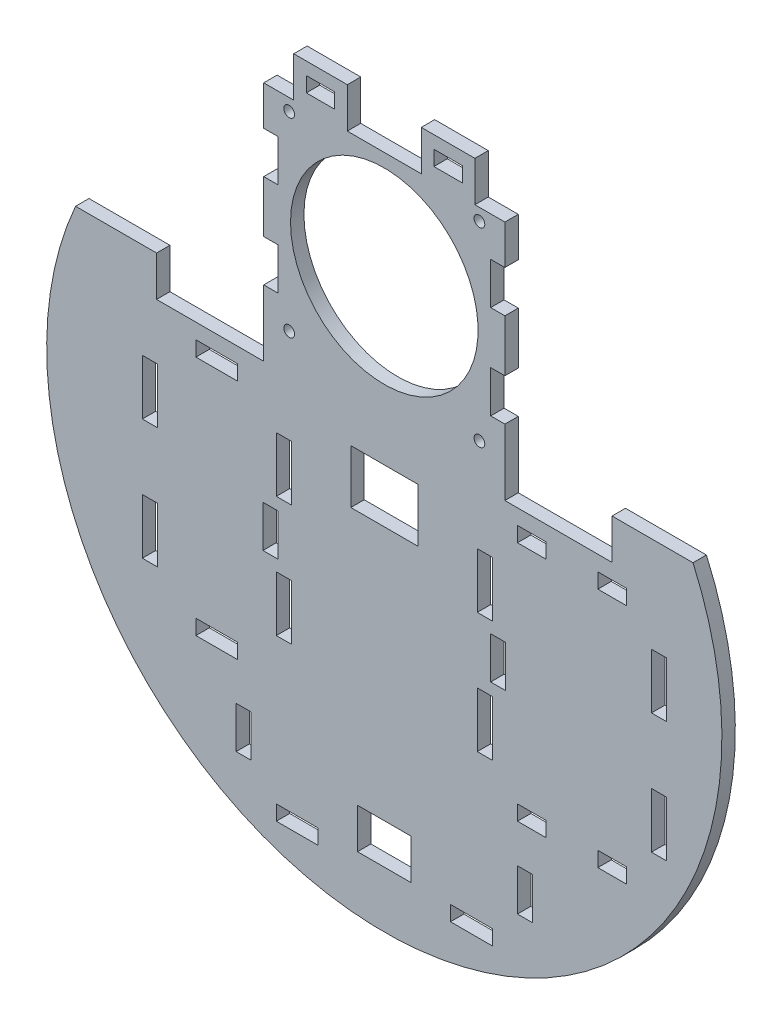
from build123d import *

# Parameters (mm, degrees)
SKETCH1_R           = 35
SKETCH1_R_2         = 2
SKETCH1_W           = 20
SKETCH1_H           = 15
SKETCH1_W_2         = 25
SKETCH1_H_2         = 20
SKETCH1_W_3         = 10.6
SKETCH1_H_3         = 5.6
SKETCH1_W_4         = 15.6
SKETCH1_W_5         = 5.6
SKETCH1_H_4         = 20.6
SKETCH1_H_5         = 15.6
BOSS_EXTRUDE1_DEPTH = 5


with BuildPart() as part:
    # Sketch1 → Boss-Extrude1 (new body)
    with BuildSketch(Plane(origin=(0, 0, 0), x_dir=(-1, 0, 0), z_dir=(0, 0, -1))):
        with BuildLine():
            Line((-25.476672243, 28.966950724), (-36.676672243, 28.966950724))
            Line((-36.676672243, 28.966950724), (-36.676672243, 43.966950724))
            Line((-36.676672243, 43.966950724), (-56.676672243, 43.966950724))
            Line((-56.676672243, 43.966950724), (-56.676672243, 28.966950724))
            Line((-56.676672243, 28.966950724), (-84.276672243, 28.966950724))
            Line((-84.276672243, 28.966950724), (-84.276672243, 43.966950724))
            Line((-84.276672243, 43.966950724), (-104.276672243, 43.966950724))
            Line((-104.276672243, 43.966950724), (-104.276672243, 28.966950724))
            Line((-104.276672243, 28.966950724), (-115.476672243, 28.966950724))
            Line((-115.476672243, 28.966950724), (-115.476672243, 14.266950724))
            Line((-115.476672243, 14.266950724), (-110.176672243, 14.266950724))
            Line((-110.176672243, 14.266950724), (-110.176672243, -1.333049276))
            Line((-110.176672243, -1.333049276), (-115.476672243, -1.333049276))
            Line((-115.476672243, -1.333049276), (-115.476672243, -20.733049276))
            Line((-115.476672243, -20.733049276), (-110.176672243, -20.733049276))
            Line((-110.176672243, -20.733049276), (-110.176672243, -36.333049276))
            Line((-110.176672243, -36.333049276), (-115.476672243, -36.333049276))
            Line((-115.476672243, -36.333049276), (-115.476672243, -61.033049276))
            Line((-115.476672243, -61.033049276), (-155.476672243, -61.033049276))
            Line((-155.476672243, -61.033049276), (-155.476672243, -46.033049276))
            Line((-155.476672243, -46.033049276), (-185.693858461, -46.033049276))
            ThreePointArc((-185.693858461, -46.033049276), (-70.476672243, -223.033049276), (44.740513975, -46.033049276))
            Line((44.740513975, -46.033049276), (14.523327757, -46.033049276))
            Line((14.523327757, -46.033049276), (14.523327757, -61.033049276))
            Line((14.523327757, -61.033049276), (-25.476672243, -61.033049276))
            Line((-25.476672243, -61.033049276), (-25.476672243, -36.333049276))
            Line((-25.476672243, -36.333049276), (-30.776672243, -36.333049276))
            Line((-30.776672243, -36.333049276), (-30.776672243, -20.733049276))
            Line((-30.776672243, -20.733049276), (-25.476672243, -20.733049276))
            Line((-25.476672243, -20.733049276), (-25.476672243, -1.333049276))
            Line((-25.476672243, -1.333049276), (-30.776672243, -1.333049276))
            Line((-30.776672243, -1.333049276), (-30.776672243, 14.266950724))
            Line((-30.776672243, 14.266950724), (-25.476672243, 14.266950724))
            Line((-25.476672243, 14.266950724), (-25.476672243, 28.966950724))
        make_face()
        with Locations((-70.476672243, -11.033049276)):
            Circle(SKETCH1_R, mode=Mode.SUBTRACT)
        with Locations((-34.976672243, 24.466950724)):
            Circle(SKETCH1_R_2, mode=Mode.SUBTRACT)
        with Locations((-105.976672243, 24.466950724)):
            Circle(SKETCH1_R_2, mode=Mode.SUBTRACT)
        with Locations((-105.976672243, -46.533049276)):
            Circle(SKETCH1_R_2, mode=Mode.SUBTRACT)
        with Locations((-34.976672243, -46.533049276)):
            Circle(SKETCH1_R_2, mode=Mode.SUBTRACT)
        with Locations((-70.476672243, -194.533049276)):
            Rectangle(SKETCH1_W, SKETCH1_H, mode=Mode.SUBTRACT)
        with Locations((-70.476672243, -82.033049276)):
            Rectangle(SKETCH1_W_2, SKETCH1_H_2, mode=Mode.SUBTRACT)
        with Locations((-46.676672243, 36.466950724)):
            Rectangle(SKETCH1_W_3, SKETCH1_H_3, mode=Mode.SUBTRACT)
        with Locations((-94.276672243, 36.466950724)):
            Rectangle(SKETCH1_W_3, SKETCH1_H_3, mode=Mode.SUBTRACT)
        with Locations((-7.976672243, -69.533049276)):
            Rectangle(SKETCH1_W_4, SKETCH1_H_3, mode=Mode.SUBTRACT)
        with Locations((17.023327757, -92.033049276)):
            Rectangle(SKETCH1_W_5, SKETCH1_H_4, mode=Mode.SUBTRACT)
        with Locations((-32.976672243, -92.033049276)):
            Rectangle(SKETCH1_W_5, SKETCH1_H_4, mode=Mode.SUBTRACT)
        with Locations((-27.976672243, -114.533049276)):
            Rectangle(SKETCH1_W_5, SKETCH1_H_5, mode=Mode.SUBTRACT)
        with Locations((17.023327757, -137.033049276)):
            Rectangle(SKETCH1_W_5, SKETCH1_H_4, mode=Mode.SUBTRACT)
        with Locations((-7.976672243, -159.533049276)):
            Rectangle(SKETCH1_W_4, SKETCH1_H_3, mode=Mode.SUBTRACT)
        with Locations((-32.976672243, -137.033049276)):
            Rectangle(SKETCH1_W_5, SKETCH1_H_4, mode=Mode.SUBTRACT)
        with Locations((-17.976672243, -184.533049276)):
            Rectangle(SKETCH1_W_5, SKETCH1_H_5, mode=Mode.SUBTRACT)
        with Locations((-37.976672243, -204.533049276)):
            Rectangle(SKETCH1_W_4, SKETCH1_H_3, mode=Mode.SUBTRACT)
        with Locations((-102.976672243, -204.533049276)):
            Rectangle(SKETCH1_W_4, SKETCH1_H_3, mode=Mode.SUBTRACT)
        with Locations((-122.976672243, -184.533049276)):
            Rectangle(SKETCH1_W_5, SKETCH1_H_5, mode=Mode.SUBTRACT)
        with Locations((-125.476672243, -159.533049276)):
            Rectangle(SKETCH1_W_3, SKETCH1_H_3, mode=Mode.SUBTRACT)
        with Locations((-155.476672243, -159.533049276)):
            Rectangle(SKETCH1_W_3, SKETCH1_H_3, mode=Mode.SUBTRACT)
        with Locations((-107.976672243, -137.033049276)):
            Rectangle(SKETCH1_W_5, SKETCH1_H_4, mode=Mode.SUBTRACT)
        with Locations((-172.976672243, -137.033049276)):
            Rectangle(SKETCH1_W_5, SKETCH1_H_4, mode=Mode.SUBTRACT)
        with Locations((-112.976672243, -114.533049276)):
            Rectangle(SKETCH1_W_5, SKETCH1_H_5, mode=Mode.SUBTRACT)
        with Locations((-107.976672243, -92.033049276)):
            Rectangle(SKETCH1_W_5, SKETCH1_H_4, mode=Mode.SUBTRACT)
        with Locations((-172.976672243, -92.033049276)):
            Rectangle(SKETCH1_W_5, SKETCH1_H_4, mode=Mode.SUBTRACT)
        with Locations((-125.476672243, -69.533049276)):
            Rectangle(SKETCH1_W_3, SKETCH1_H_3, mode=Mode.SUBTRACT)
        with Locations((-155.476672243, -69.533049276)):
            Rectangle(SKETCH1_W_3, SKETCH1_H_3, mode=Mode.SUBTRACT)
    extrude(amount=BOSS_EXTRUDE1_DEPTH)


solid = part.part
